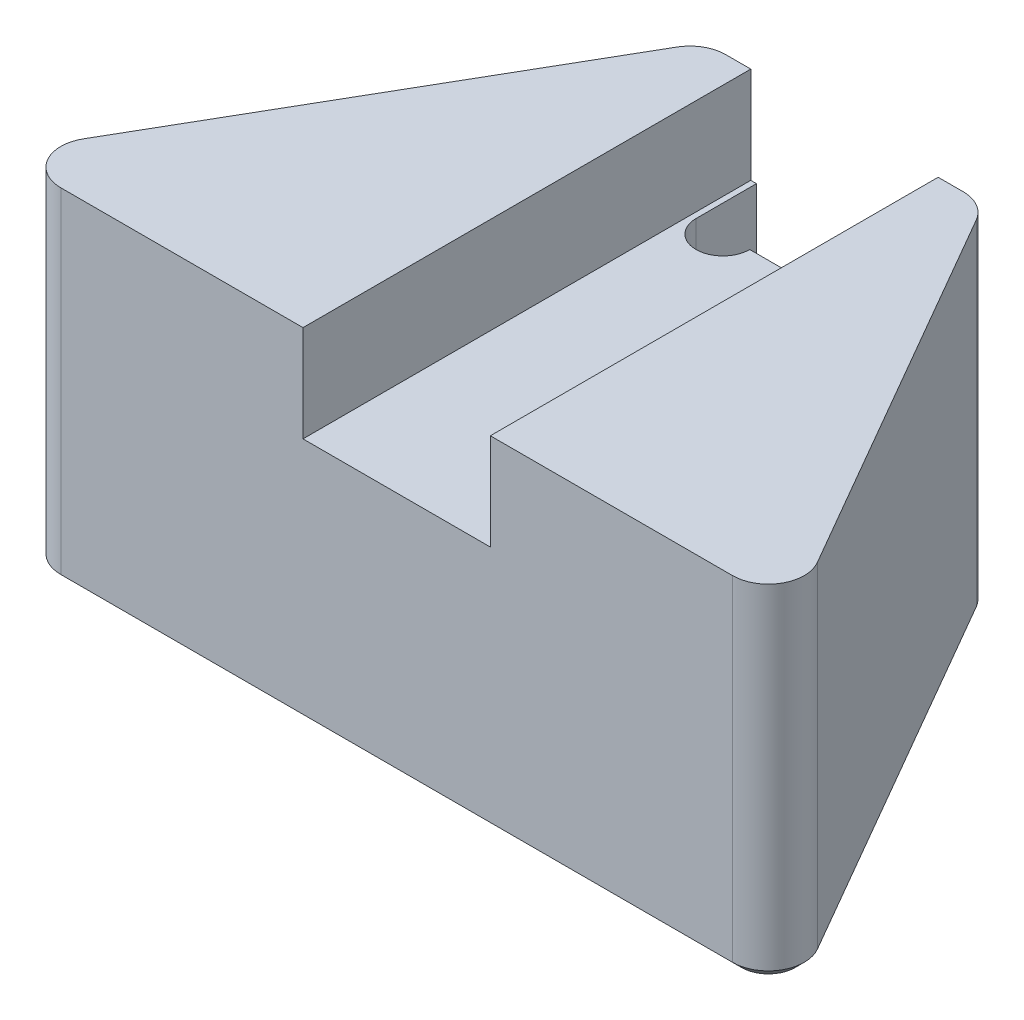
from build123d import *

# Parameters (mm, degrees)
BOSS_EXTRUDE1_DEPTH = 9.6
FILLET5_R           = 2
SKETCH7_W           = 10.46
SKETCH7_H           = 5.38
CUT_EXTRUDE6_DEPTH  = 34.879754173
SKETCH11_W          = 9.825
SKETCH11_H          = 9.825
CUT_EXTRUDE9_DEPTH  = 3.375
SKETCH12_R          = 1.5
CUT_EXTRUDE10_DEPTH = 9.825
CHAMFER1_SIZE       = 0.5


with BuildPart() as part:
    # Sketch1 → Boss-Extrude1 (new, symmetric)
    with BuildSketch(Plane(origin=(0, 0, 0), x_dir=(1, 0, 0), z_dir=(0, 1, 0))):
        Polygon((-14.297771125, -12.5), (14.297771125, -12.5), (22.216878365, -12.5), (7.783121635, 12.5), (-7.783121635, 12.5), (-22.216878365, -12.5), align=None)
    extrude(amount=BOSS_EXTRUDE1_DEPTH, both=True)

    # Fillet5
    fillet5_edges = [part.edges().sort_by_distance(p)[0] for p in [
        (-22.216878365, 0, 12.5),
        (-7.783121635, 0, -12.5),
        (7.783121635, 0, -12.5),
        (22.216878365, 0, 12.5),
    ]]
    fillet(fillet5_edges, radius=FILLET5_R)

    # Sketch7 → Cut-Extrude6 (cut, through all)
    with BuildSketch(Plane.XY.offset(12.5)):
        with Locations((0, 6.91)):
            Rectangle(SKETCH7_W, SKETCH7_H)
    extrude(amount=-CUT_EXTRUDE6_DEPTH, mode=Mode.SUBTRACT)

    # Sketch11 → Cut-Extrude9 (cut)
    with BuildSketch(Plane(origin=(0, 0, -12.5), x_dir=(-1, 0, 0), z_dir=(0, 0, -1))):
        with Locations((0, -0.6925)):
            Rectangle(SKETCH11_W, SKETCH11_H)
    extrude(amount=-CUT_EXTRUDE9_DEPTH, mode=Mode.SUBTRACT)

    # Sketch12 → Cut-Extrude10 (cut)
    with BuildSketch(Plane(origin=(0, 4.22, 0), x_dir=(1, 0, 0), z_dir=(0, 1, 0))):
        with Locations((3.4125, 9.125)):
            Circle(SKETCH12_R)
        with Locations((-3.4125, 9.125)):
            Circle(SKETCH12_R)
    extrude(amount=-CUT_EXTRUDE10_DEPTH, mode=Mode.SUBTRACT)

    # Chamfer1
    chamfer1_edges = [part.edges().sort_by_distance(p)[0] for p in [
        (-14.422649731, -9.6, -1),
        (0, -9.6, 12.5),
        (0, -9.6, -12.5),
        (14.422649731, -9.6, -1),
        (-20.484827557, -9.6, 11.5),
        (20.484827557, -9.6, 11.5),
        (7.628421097, -9.6, -12.232050808),
        (-7.628421097, -9.6, -12.232050808),
    ]]
    chamfer(chamfer1_edges, length=CHAMFER1_SIZE)


solid = part.part
